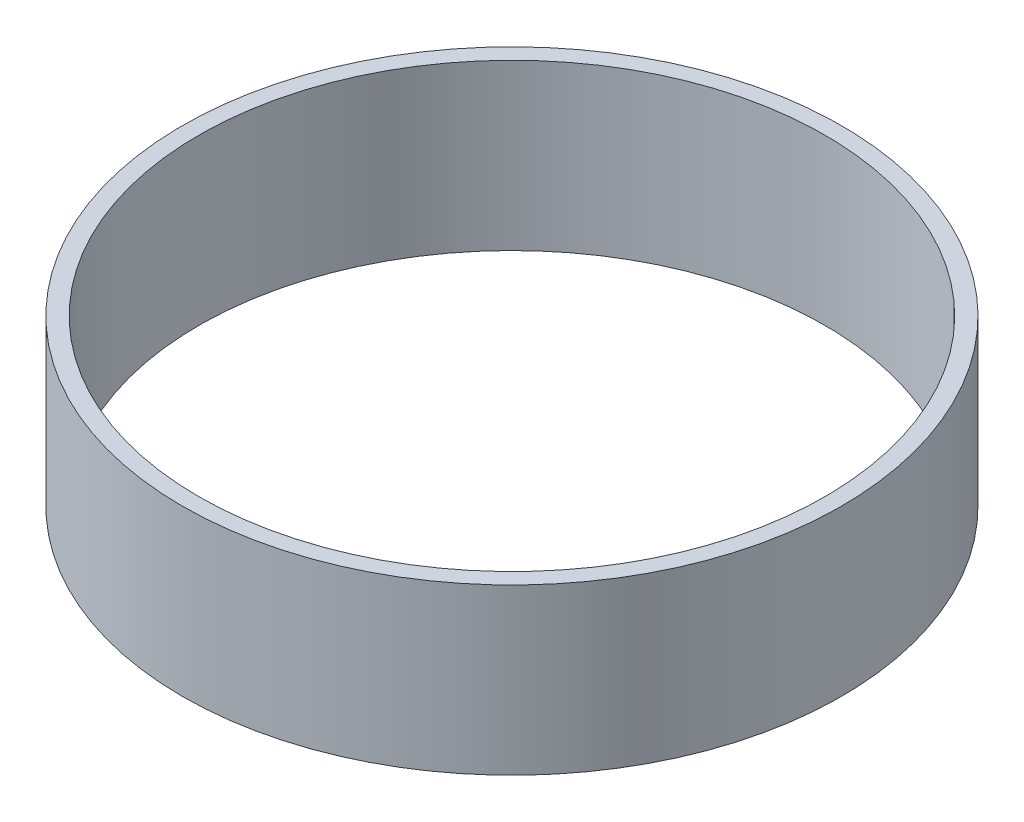
from build123d import *

# Parameters (mm, degrees)
SKETCH1_R           = 400
SKETCH1_R_2         = 380
BOSS_EXTRUDE1_DEPTH = 200


with BuildPart() as part:
    # Sketch1 → Boss-Extrude1 (new body)
    with BuildSketch(Plane(origin=(0, 0, 0), x_dir=(1, 0, 0), z_dir=(0, 1, 0))):
        with Locations(Location((0, 0, 0), (0, 0, 270))):
            Circle(SKETCH1_R)
        with Locations(Location((0, 0, 0), (0, 0, 270))):
            Circle(SKETCH1_R_2, mode=Mode.SUBTRACT)
    extrude(amount=BOSS_EXTRUDE1_DEPTH)


solid = part.part
